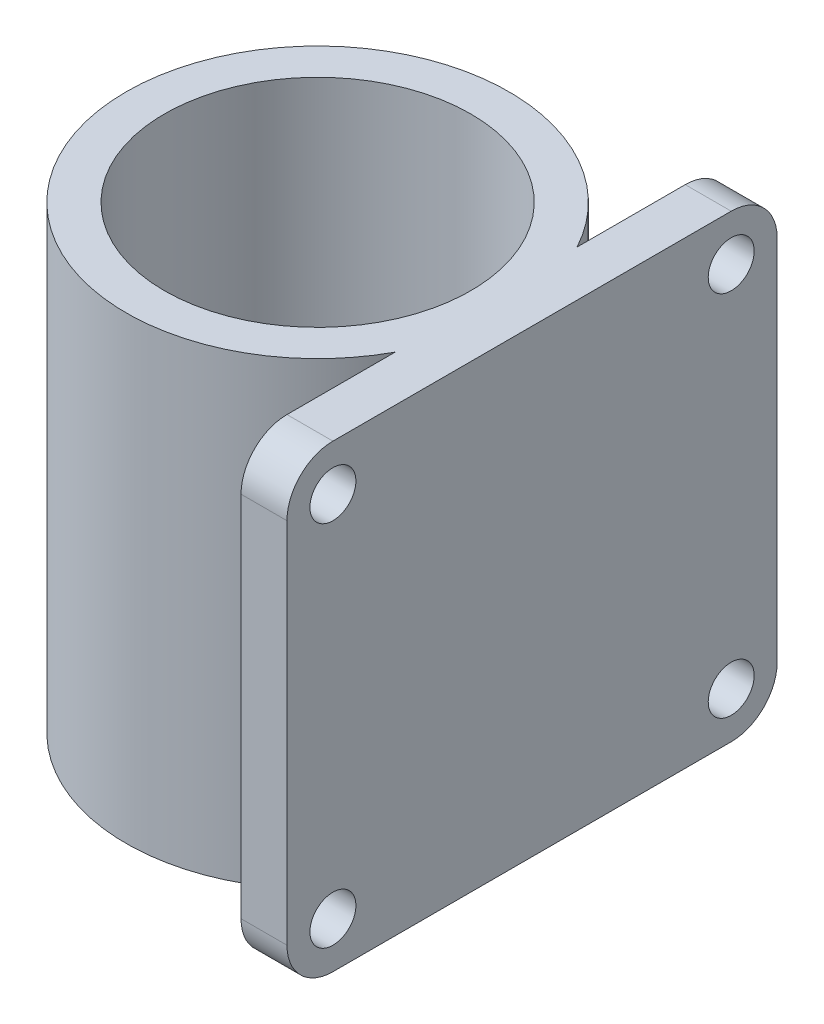
from build123d import *

# Parameters (mm, degrees)
SKETCH_1_R          = 12.5
SKETCH_1_R_2        = 10
EXTRUDE_1_DEPTH     = 30
SKETCH_2_W          = 3
SKETCH_2_H          = 32
EXTRUDE_2_DEPTH     = 30
CUT_EXTRUDE_2_DEPTH = 0.5
SKETCH_5_R          = 1.5
CUT_EXTRUDE_3_DEPTH = 42.617304093
FILLET_1_R          = 3


with BuildPart() as part:
    # 草图1 → 凸台-拉伸1 (new body)
    with BuildSketch(Plane(origin=(0, 0, 0), x_dir=(1, 0, 0), z_dir=(0, 1, 0))):
        with Locations(Location((0, 0, 0), (0, 0, 270))):
            Circle(SKETCH_1_R)
        with Locations(Location((0, 0, 0), (0, 0, 270))):
            Circle(SKETCH_1_R_2, mode=Mode.SUBTRACT)
    extrude(amount=EXTRUDE_1_DEPTH)

    # 草图2 → 凸台-拉伸2 (add)
    with BuildSketch(Plane(origin=(0, 0, 0), x_dir=(1, 0, 0), z_dir=(0, 1, 0))):
        with Locations((12.5, 0)):
            Rectangle(SKETCH_2_W, SKETCH_2_H)
    extrude(amount=EXTRUDE_2_DEPTH)

    # 草图4 → 切除-拉伸2 (cut)
    with BuildSketch(Plane.ZY.offset(-11)):
        Polygon((15.216666667, 27), (14.008333333, 29.092894726), (11.591666667, 29.092894726), (10.383333333, 27), (11.591666667, 24.907105274), (14.008333333, 24.907105274), align=None)
        Polygon((-10.78933236, 1.659293687), (-12.955751906, 0.588357588), (-14.966419546, 1.929063901), (-14.81066764, 4.340706313), (-12.644248094, 5.411642412), (-10.633580454, 4.070936099), align=None)
        Polygon((12.955751906, 0.588357588), (14.966419546, 1.929063901), (14.81066764, 4.340706313), (12.644248094, 5.411642412), (10.633580454, 4.070936099), (10.78933236, 1.659293687), align=None)
        Polygon((-14.008333333, 24.907105274), (-15.216666667, 27), (-14.008333333, 29.092894726), (-11.591666667, 29.092894726), (-10.383333333, 27), (-11.591666667, 24.907105274), align=None)
    extrude(amount=-CUT_EXTRUDE_2_DEPTH, mode=Mode.SUBTRACT)

    # 草图5 → 切除-拉伸3 (cut, through all)
    with BuildSketch(Plane.ZY.offset(-11.5)):
        with Locations(Location((-13, 27, 0), (0, 0, 270))):
            Circle(SKETCH_5_R)
        with Locations(Location((13, 27, 0), (0, 0, 270))):
            Circle(SKETCH_5_R)
        with Locations(Location((13, 3, 0), (0, 0, 270))):
            Circle(SKETCH_5_R)
        with Locations(Location((-13, 3, 0), (0, 0, 270))):
            Circle(SKETCH_5_R)
    extrude(amount=-CUT_EXTRUDE_3_DEPTH, mode=Mode.SUBTRACT)

    # 圆角1
    fillet_1_edges = [part.edges().sort_by_distance(p)[0] for p in [
        (12.5, 30, 16),
        (12.5, 30, -16),
        (12.5, 0, -16),
        (12.5, 0, 16),
    ]]
    fillet(fillet_1_edges, radius=FILLET_1_R)


solid = part.part
